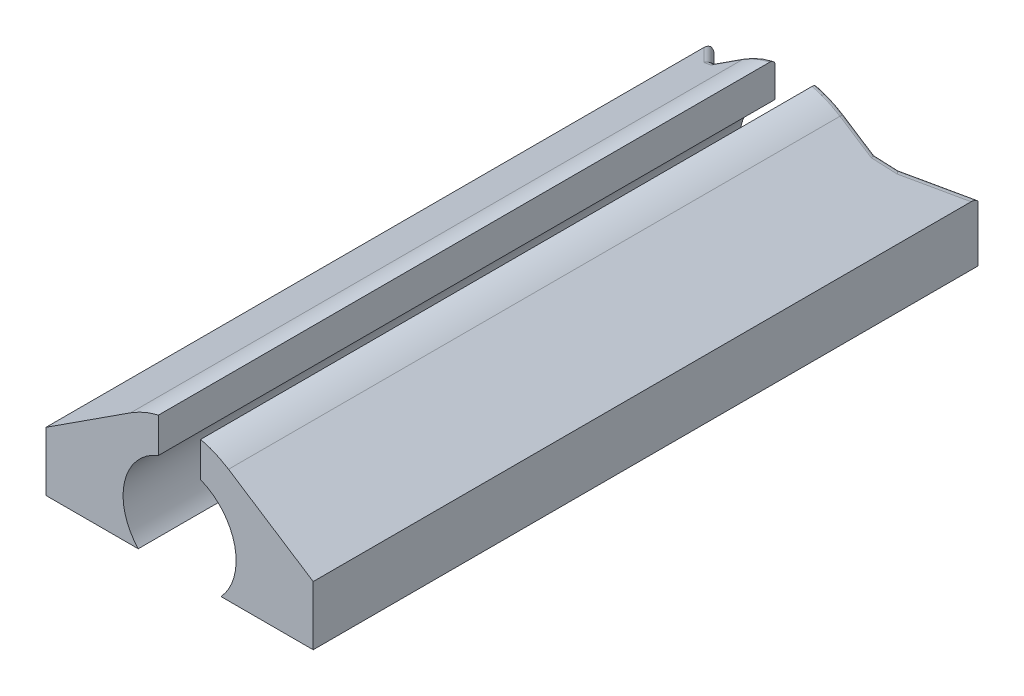
from build123d import *
from OCP.BRepFilletAPI import BRepFilletAPI_MakeChamfer

# Parameters (mm, degrees)
EXTRUDE_1_DEPTH          = 60
EXTRUDE_2_DEPTH          = 11
EXTRUDE_2_DEPTH_BACK     = 7.5
CUT_EXTRUDE_1_DEPTH      = 77.58616063
CUT_EXTRUDE_1_DEPTH_BACK = 77.58616063
CHAMFER_1_SIZE           = 1.2
CHAMFER_1_SIZE2          = 2.318221983
CHAMFER_1_SIZE2_2        = 0.621165708
FILLET_1_R               = 1


with BuildPart() as part:
    # 스케치1 → 보스-돌출1 (new, symmetric)
    with BuildSketch(Plane.XY):
        with BuildLine():
            Line((-26, -7.5), (-15.811388301, -7.5))
            ThreePointArc((-15.811388301, -7.5), (-16.835996569, 4.774852829), (-9.519745153, 14.684156503))
            Line((-9.519745153, 14.684156503), (-26, 4))
            Line((-26, 4), (-26, -7.5))
        make_face()
        with BuildLine():
            ThreePointArc((-9.519745153, 14.684156503), (-16.835996569, 4.774852829), (-15.811388301, -7.5))
            Line((-15.811388301, -7.5), (-8.04673847, -7.5))
            ThreePointArc((-8.04673847, -7.5), (-10.736544018, 2.393036259), (-4.1, 10.207350293))
            Line((-4.1, 10.207350293), (-4.1, 17.012936255))
            ThreePointArc((-4.1, 17.012936255), (-6.90870236, 16.078551916), (-9.519745153, 14.684156503))
        make_face()
    extrude(amount=EXTRUDE_1_DEPTH, both=True)

    # 스케치2 → 보스-돌출2 (add, two sides: drawn at the far end of the back side and taken through both)
    with BuildSketch(Plane(origin=(0, 0, 0), x_dir=(1, 0, 0), z_dir=(0, 1, 0)).offset(-EXTRUDE_2_DEPTH_BACK)):
        Polygon((-26, 60), (-26, 70), (-16, 60), align=None)
    extrude(amount=EXTRUDE_2_DEPTH + EXTRUDE_2_DEPTH_BACK)

    # 스케치3 → 컷-돌출1 (cut, two sides: drawn at the far end of the back side and taken through both)
    with BuildSketch(Plane.XY.offset(-CUT_EXTRUDE_1_DEPTH_BACK)):
        Polygon((-26, 4), (-15.202537057, 11), (-26, 11), align=None)
    extrude(amount=CUT_EXTRUDE_1_DEPTH + CUT_EXTRUDE_1_DEPTH_BACK, mode=Mode.SUBTRACT)

    # 모따기1: one chamfer whose edges measure the first distance from different faces: ONE call of the kernel's chamfer builder (chamfer() names one face for all edges)
    chamfer_1_edges_1 = [part.edges().sort_by_distance(p)[0] for p in [
        (-16, 1.491502211, -60),
    ]]
    chamfer_1_side_1 = [part.faces().sort_by_distance(p)[0] for p in [
        (-11.32981626, 5.117453967, -60),
    ]]
    chamfer_1_edges_2 = [part.edges().sort_by_distance(p)[0] for p in [
        (-26, -1.75, -70),
    ]]
    chamfer_1_side_2 = [part.faces().sort_by_distance(p)[0] for p in [
        (-20.633517425, -0.010453487, -64.633517425),
    ]]
    chamfer_1 = BRepFilletAPI_MakeChamfer(part.part.solid().wrapped)
    for e in chamfer_1_edges_1:
        chamfer_1.Add(CHAMFER_1_SIZE, CHAMFER_1_SIZE2, e.wrapped, chamfer_1_side_1[0].wrapped)  # the first distance lies on this face
    for e in chamfer_1_edges_2:
        chamfer_1.Add(CHAMFER_1_SIZE, CHAMFER_1_SIZE2_2, e.wrapped, chamfer_1_side_2[0].wrapped)  # the first distance lies on this face
    add(Compound.cast(chamfer_1.Shape()), mode=Mode.REPLACE)

    # 필렛1
    fillet_1_edges = [part.edges().sort_by_distance(p)[0] for p in [
        (-12.159872577, 12.972560728, -60),
        (-21.395351174, 6.98519587, -65.395351174),
        (-16.219615242, 10.340627763, -60.819615242),
        (-6.90870236, 16.078551916, -60),
    ]]
    fillet(fillet_1_edges, radius=FILLET_1_R)


with BuildPart() as body_2:
    # 대칭 복사5: mirrored copy
    add(part.part.mirror(Plane(origin=(0, 0, 0), x_dir=(0, 0, 1), z_dir=(1, 0, 0))))


solid = Compound([part.part, body_2.part])
